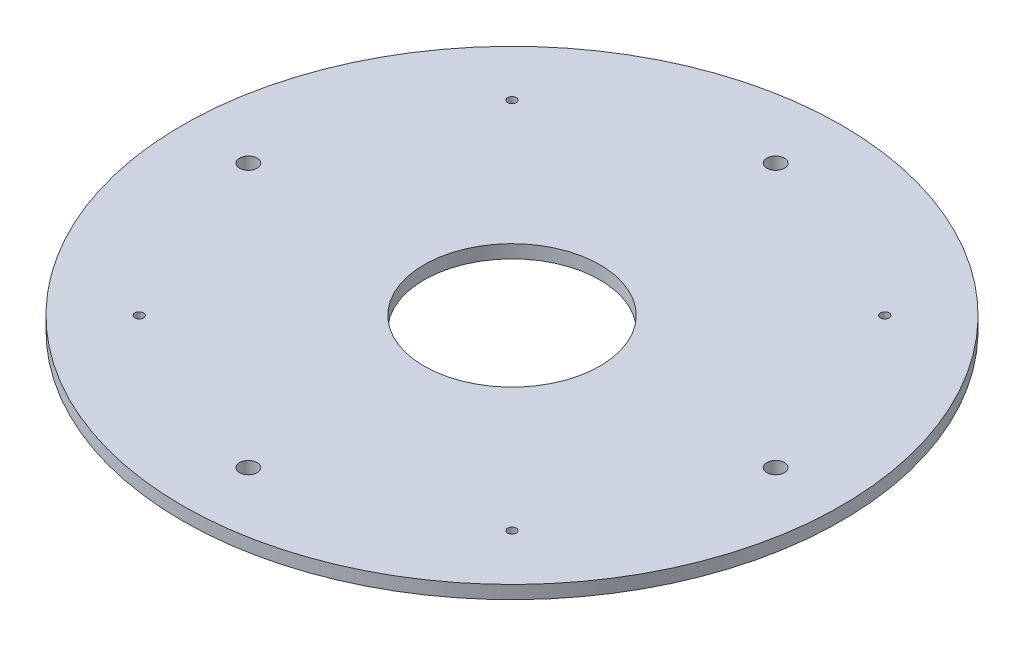
from build123d import *

# Parameters (mm, degrees)
SKETCH_1_R               = 75
SKETCH_1_R_2             = 20
EXTRUDE_1_DEPTH          = 3
SKETCH_2_R               = 1
CUT_EXTRUDE_3_DEPTH      = 10
PATTERN_CIRCULAR_3_COUNT = 4
SKETCH_3_R               = 2
CUT_EXTRUDE_4_DEPTH      = 10
PATTERN_CIRCULAR_4_COUNT = 4


with BuildPart() as part:
    # 草圖1 → 填料-伸長1 (new body)
    with BuildSketch(Plane(origin=(0, 0, 0), x_dir=(1, 0, 0), z_dir=(0, 1, 0))):
        with Locations(Location((0, 0, 0), (0, 0, 270))):
            Circle(SKETCH_1_R)
        with Locations(Location((0, 0, 0), (0, 0, 270))):
            Circle(SKETCH_1_R_2, mode=Mode.SUBTRACT)
    extrude(amount=EXTRUDE_1_DEPTH)

    # 草圖2 → 除料-伸長3 (cut)
    with BuildSketch(Plane(origin=(0, 3, 0), x_dir=(1, 0, 0), z_dir=(0, 1, 0))):
        with Locations(Location((42.426406871, 42.426406871, 0), (0, 0, 270))):
            Circle(SKETCH_2_R)
    cut_extrude_3 = extrude(amount=-CUT_EXTRUDE_3_DEPTH, mode=Mode.SUBTRACT)

    # 環狀複製排列3: 除料-伸長3 ×4 about axis
    pattern_circular_3_axis = Axis((0, 0, 0), (0, 1, 0))
    for i in range(1, PATTERN_CIRCULAR_3_COUNT):
        add(cut_extrude_3.rotate(pattern_circular_3_axis, i * 360 / PATTERN_CIRCULAR_3_COUNT), mode=Mode.SUBTRACT)

    # 草圖3 → 除料-伸長4 (cut)
    with BuildSketch(Plane(origin=(0, 3, 0), x_dir=(1, 0, 0), z_dir=(0, 1, 0))):
        with Locations(Location((-60, 0, 0), (0, 0, 270))):
            Circle(SKETCH_3_R)
    cut_extrude_4 = extrude(amount=-CUT_EXTRUDE_4_DEPTH, mode=Mode.SUBTRACT)

    # 環狀複製排列4: 除料-伸長4 ×4 about axis
    pattern_circular_4_axis = Axis((0, 0, 0), (0, 1, 0))
    for i in range(1, PATTERN_CIRCULAR_4_COUNT):
        add(cut_extrude_4.rotate(pattern_circular_4_axis, i * 360 / PATTERN_CIRCULAR_4_COUNT), mode=Mode.SUBTRACT)


solid = part.part
